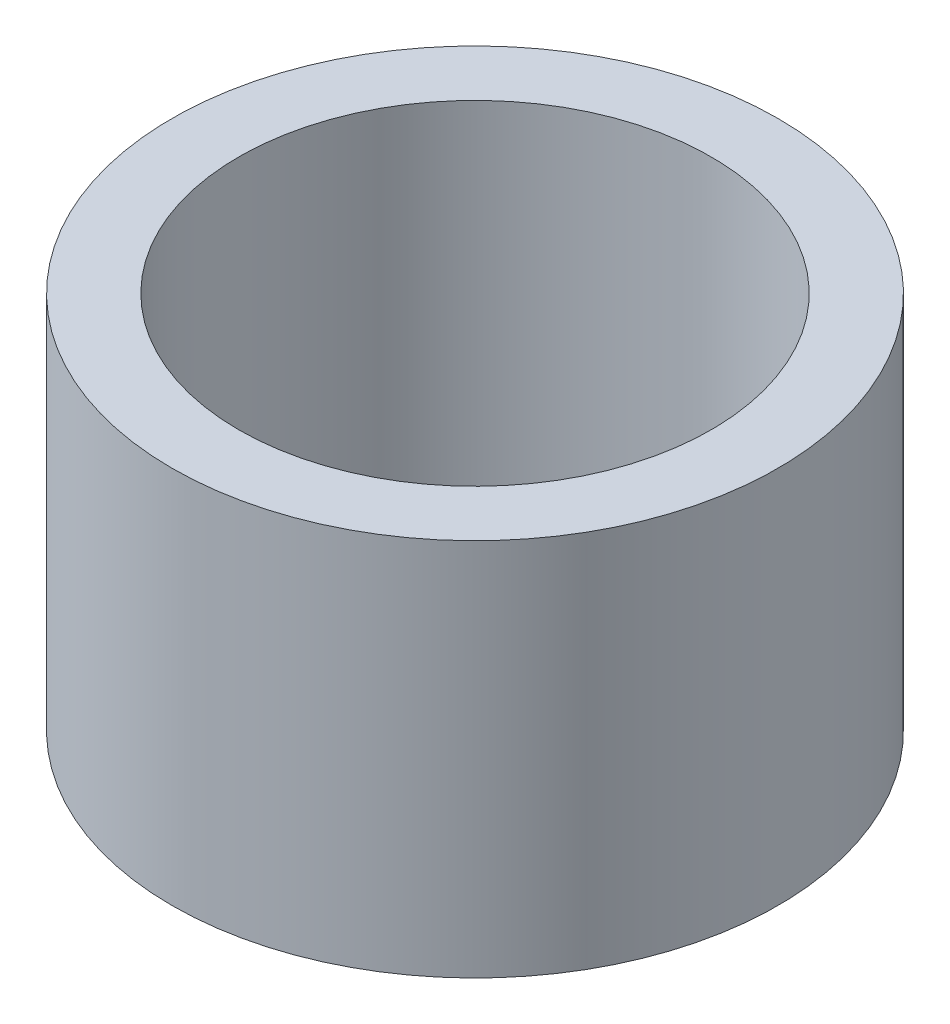
from build123d import *

# Parameters (mm, degrees)
SKETCH1_R           = 20
SKETCH1_R_2         = 15.6
BOSS_EXTRUDE1_DEPTH = 25


with BuildPart() as part:
    # Sketch1 → Boss-Extrude1 (new body)
    with BuildSketch(Plane(origin=(0, 0, 0), x_dir=(1, 0, 0), z_dir=(0, 1, 0))):
        with Locations(Location((0, 0, 0), (0, 0, 270))):
            Circle(SKETCH1_R)
        with Locations(Location((0, 0, 0), (0, 0, 270))):
            Circle(SKETCH1_R_2, mode=Mode.SUBTRACT)
    extrude(amount=BOSS_EXTRUDE1_DEPTH)


solid = part.part
